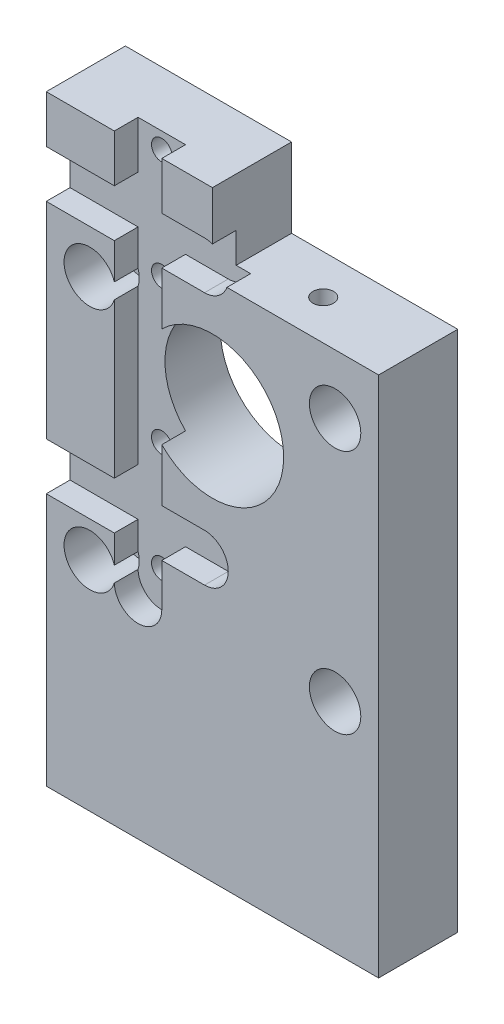
from build123d import *

# Parameters (mm, degrees)
BOSS_EXTRUDE1_DEPTH                      = 10
CUT_EXTRUDE1_REACH                       = 89.407
SKETCH2_R                                = 9
CUT_EXTRUDE2_DEPTH                       = 3
CBORE_FOR_M3_PAN_HEAD_SCREW1_D           = 3.4
CBORE_FOR_M3_PAN_HEAD_SCREW1_CBORE_D     = 6.5
CBORE_FOR_M3_PAN_HEAD_SCREW1_CBORE_DEPTH = 6.5
M3X0_5_TAPPED_HOLE1_D                    = 2.6
M3X0_5_TAPPED_HOLE2_D                    = 2.6
M3X0_5_TAPPED_HOLE2_DEPTH                = 9
M3X0_5_TAPPED_HOLE2_TIP                  = 0.781118805
M3X0_5_TAPPED_HOLE3_D                    = 2.6
M3X0_5_TAPPED_HOLE3_DEPTH                = 9
M3X0_5_TAPPED_HOLE3_TIP                  = 0.781118805


with BuildPart() as part:
    # Sketch1 → Boss-Extrude1 (new body)
    with BuildSketch(Plane.XY):
        Polygon((0, 0), (42, 0), (42, 66), (21, 66), (21, 76), (0, 76), (0, 66), align=None)
    extrude(amount=BOSS_EXTRUDE1_DEPTH)

    # Sketch2 → Cut-Extrude1 (cut, up to next)
    with BuildSketch(Plane.XY.offset(10), mode=Mode.PRIVATE) as cut_extrude1_sk1:
        with Locations((21, 51)):
            Circle(SKETCH2_R)
    cut_extrude1_tool1 = extrude(cut_extrude1_sk1.sketch, amount=-CUT_EXTRUDE1_REACH, mode=Mode.PRIVATE) & part.part
    add(cut_extrude1_tool1.solids().sort_by_distance((21, 51, 10))[0], mode=Mode.SUBTRACT)

    # Sketch3 → Cut-Extrude2 (cut)
    with BuildSketch(Plane.XY.offset(10)):
        with BuildLine():
            Line((8.6, 64), (8.6, 38))
            Line((8.6, 38), (0, 38))
            Line((0, 38), (0, 32))
            Line((0, 32), (8.6, 32))
            Line((8.6, 32), (8.6, 26.6))
            ThreePointArc((8.6, 26.6), (11.6, 23.6), (14.6, 26.6))
            Line((14.6, 26.6), (14.6, 32))
            Line((14.6, 32), (20, 32))
            ThreePointArc((20, 32), (23, 35), (20, 38))
            Line((20, 38), (14.6, 38))
            Line((14.6, 38), (14.6, 64))
            Line((14.6, 64), (20, 64))
            ThreePointArc((20, 64), (23, 67), (20, 70))
            Line((20, 70), (14.6, 70))
            Line((14.6, 70), (14.6, 76))
            Line((14.6, 76), (8.6, 76))
            Line((8.6, 76), (8.6, 70))
            Line((8.6, 70), (0, 70))
            Line((0, 70), (0, 64))
            Line((0, 64), (8.6, 64))
        make_face()
    extrude(amount=-CUT_EXTRUDE2_DEPTH, mode=Mode.SUBTRACT)

    # CBORE for M3 Pan Head Screw1 (through all)
    with Locations(Plane.XY.offset(10)):
        with Locations((5.5, 58.5), (36.5, 58.5), (5.5, 27.5), (36.5, 27.5)):
            CounterBoreHole(CBORE_FOR_M3_PAN_HEAD_SCREW1_D / 2, CBORE_FOR_M3_PAN_HEAD_SCREW1_CBORE_D / 2, CBORE_FOR_M3_PAN_HEAD_SCREW1_CBORE_DEPTH)

    # M3x0.5 Tapped Hole1 (through all)
    with Locations(Plane.XY.offset(7)):
        with Locations((11.6, 73.9), (11.6, 60.1), (11.6, 41.9), (11.6, 28.1)):
            Hole(M3X0_5_TAPPED_HOLE1_D / 2)

    # M3x0.5 Tapped Hole2
    with Locations(Plane(origin=(0, 0, 0), x_dir=(-1, 0, 0), z_dir=(0, -1, 0))):
        with Locations((-32, -5), (-10, -5)):
            Hole(M3X0_5_TAPPED_HOLE2_D / 2, depth=M3X0_5_TAPPED_HOLE2_DEPTH)
            with Locations((0, 0, -(M3X0_5_TAPPED_HOLE2_DEPTH + M3X0_5_TAPPED_HOLE2_TIP / 2))):  # 118° drill point
                Cone(0, M3X0_5_TAPPED_HOLE2_D / 2, M3X0_5_TAPPED_HOLE2_TIP, mode=Mode.SUBTRACT)

    # M3x0.5 Tapped Hole3
    with Locations(Plane(origin=(0, 66, 0), x_dir=(1, 0, 0), z_dir=(0, 1, 0))):
        with Locations((30, -5)):
            Hole(M3X0_5_TAPPED_HOLE3_D / 2, depth=M3X0_5_TAPPED_HOLE3_DEPTH)
            with Locations((0, 0, -(M3X0_5_TAPPED_HOLE3_DEPTH + M3X0_5_TAPPED_HOLE3_TIP / 2))):  # 118° drill point
                Cone(0, M3X0_5_TAPPED_HOLE3_D / 2, M3X0_5_TAPPED_HOLE3_TIP, mode=Mode.SUBTRACT)


solid = part.part
